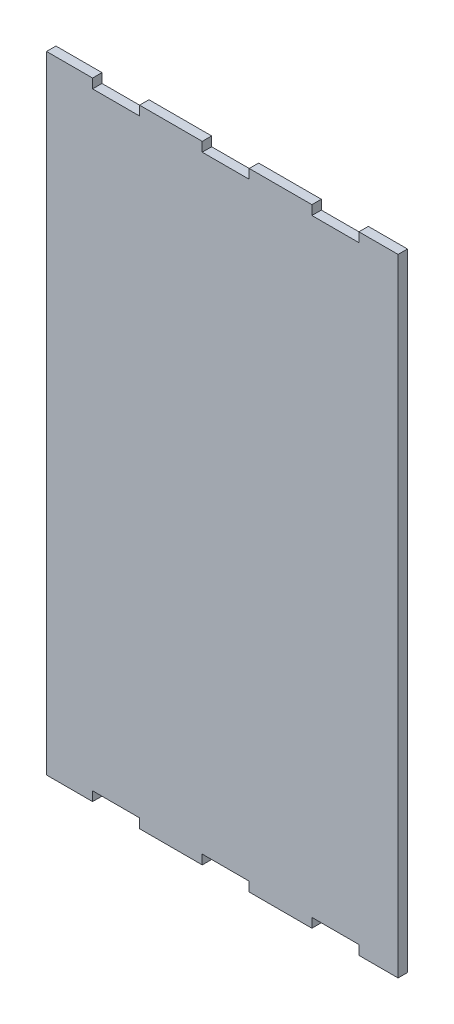
from build123d import *

# Parameters (mm, degrees)
SKETCH_1_W          = 110
SKETCH_1_H          = 200
EXTRUDE_1_DEPTH     = 3
SKETCH_2_W          = 15
SKETCH_2_H          = 3
CUT_EXTRUDE_1_DEPTH = 229.273958217
SKETCH_3_W          = 2.2
SKETCH_3_H          = 200
EXTRUDE_2_DEPTH     = 3


with BuildPart() as part:
    # 草图1 → 凸台-拉伸1 (new body)
    with BuildSketch(Plane.XY):
        with Locations((55, 100)):
            Rectangle(SKETCH_1_W, SKETCH_1_H)
    extrude(amount=EXTRUDE_1_DEPTH)

    # 草图2 → 切除-拉伸1 (cut, through all)
    with BuildSketch(Plane.XY.offset(3)):
        with Locations((55, 1.5)):
            Rectangle(SKETCH_2_W, SKETCH_2_H)
        with Locations((20, 1.5)):
            Rectangle(SKETCH_2_W, SKETCH_2_H)
        with Locations((90, 1.5)):
            Rectangle(SKETCH_2_W, SKETCH_2_H)
    cut_extrude_1 = extrude(amount=-CUT_EXTRUDE_1_DEPTH, mode=Mode.SUBTRACT)

    # 镜向1: 切除-拉伸1 across plane
    add(cut_extrude_1.mirror(Plane(origin=(0, 100, 0), x_dir=(0, 0, 1), z_dir=(0, -1, 0))), mode=Mode.SUBTRACT)

    # 草图3 → 凸台-拉伸2 (add)
    with BuildSketch(Plane.XY.offset(3)):
        with Locations((-1.1, 100)):
            Rectangle(SKETCH_3_W, SKETCH_3_H)
    extrude(amount=-EXTRUDE_2_DEPTH)


solid = part.part
